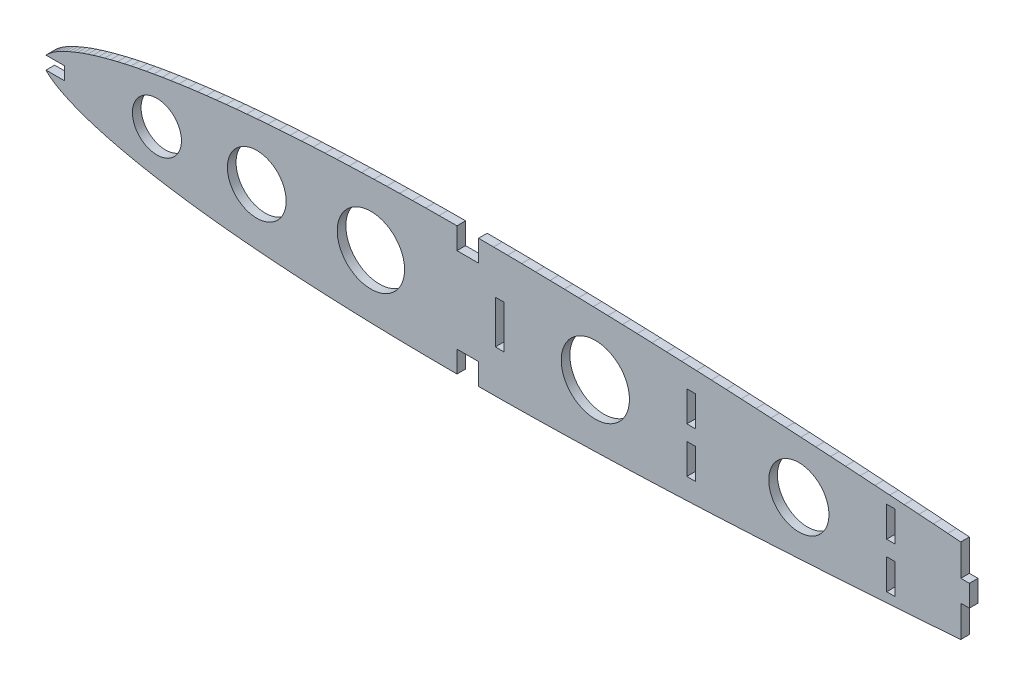
from build123d import *

# Parameters (mm, degrees)
MODEL_R         = 5.687802485
MODEL_R_2       = 6.817016928
MODEL_R_3       = 7.81584039
MODEL_R_4       = 7.917631013
MODEL_R_5       = 6.983479573
MODEL_W         = 2
MODEL_H         = 7.04538
EXTRUDE_2_DEPTH = 2


with BuildPart() as part:
    # Model → 凸台-拉伸2 (new body)
    with BuildSketch(Plane.XY):
        Polygon((62.117439421, 68.543691122), (66.37605038, 68.543691122), (66.37605038, 65.543691122), (62.117439421, 65.543691122), (62.32205038, 65.316691122), (62.68005038, 64.981691122), (63.19905038, 64.553691122), (63.74405038, 64.155691122), (64.30905038, 63.786691122), (65.04805038, 63.352691122), (65.80605038, 62.951691122), (66.57605038, 62.574691122), (67.53205038, 62.136691122), (68.49905038, 61.721691122), (69.47605038, 61.330691122), (70.64005038, 60.897691122), (71.81405038, 60.492691122), (72.99705038, 60.112691122), (74.36805038, 59.701691122), (75.74505038, 59.315691122), (77.12805038, 58.950691122), (78.69705038, 58.561691122), (80.27005038, 58.194691122), (81.84805038, 57.848691122), (83.60905038, 57.486691122), (85.37305038, 57.146691122), (87.14105038, 56.825691122), (89.08505038, 56.493691122), (91.03305038, 56.182691122), (92.98305038, 55.888691122), (95.10505038, 55.589691122), (97.22805038, 55.310691122), (99.35505038, 55.048691122), (101.64605038, 54.784691122), (103.93805038, 54.539691122), (106.23305038, 54.309691122), (108.68205038, 54.081691122), (111.13305038, 53.870691122), (113.58505038, 53.674691122), (116.18305038, 53.483691122), (118.78205038, 53.308691122), (121.38305038, 53.148691122), (124.12105038, 52.995691122), (126.85905038, 52.857691122), (129.59805038, 52.734691122), (132.46505038, 52.619691122), (135.33105038, 52.517691122), (138.19805038, 52.429691122), (141.18005038, 52.351691122), (144.16205038, 52.286691122), (147.14505038, 52.234691122), (150.23305038, 52.193691122), (153.32105038, 52.165691122), (157.483051726, 52.146692018), (157.482051726, 57.146692018), (162.482051726, 57.147692018), (162.483051726, 52.147692018), (165.95205038, 52.165691122), (169.21305038, 52.192691122), (172.47305038, 52.231691122), (175.73305038, 52.280691122), (179.06105038, 52.341691122), (182.38805038, 52.412691122), (185.71605038, 52.492691122), (189.10005038, 52.583691122), (192.48205038, 52.682691122), (195.86505038, 52.790691122), (199.28805038, 52.909691122), (202.71005038, 53.036691122), (206.13205038, 53.171691122), (209.58405038, 53.314691122), (213.03505038, 53.465691122), (216.48605038, 53.624691122), (219.95005038, 53.792691122), (223.41305038, 53.967691122), (226.87605038, 54.151691122), (230.34005038, 54.342691122), (233.80305038, 54.541691122), (237.26605038, 54.743691122), (240.71805038, 54.948691122), (244.16905038, 55.157691122), (247.62005038, 55.372691122), (251.04305038, 55.593691122), (254.46505038, 55.821691122), (257.88705038, 56.054691122), (261.27105038, 56.288691122), (264.65305038, 56.526691122), (268.03605038, 56.769691122), (271.36405038, 57.012691122), (274.376035029, 57.23811468), (274.376035029, 64.543691122), (276.376035029, 64.543691122), (276.376035029, 67.043691122), (276.376035029, 69.543691122), (274.376035029, 69.543691122), (274.376035029, 76.849267564), (271.36405038, 77.074691122), (268.03605038, 77.317691122), (264.65305038, 77.560691122), (261.27105038, 77.798691122), (257.88705038, 78.032691122), (254.46505038, 78.265691122), (251.04305038, 78.493691122), (247.62005038, 78.714691122), (244.16905038, 78.929691122), (240.71805038, 79.138691122), (237.26605038, 79.343691122), (233.80305038, 79.545691122), (230.34005038, 79.744691122), (226.87605038, 79.935691122), (223.41305038, 80.119691122), (219.95005038, 80.294691122), (216.48605038, 80.462691122), (213.03505038, 80.621691122), (209.58405038, 80.772691122), (206.13205038, 80.915691122), (202.71005038, 81.050691122), (199.28805038, 81.177691122), (195.86505038, 81.296691122), (192.48205038, 81.404691122), (189.10005038, 81.503691122), (185.71605038, 81.594691122), (182.38805038, 81.674691122), (179.06105038, 81.745691122), (175.73305038, 81.806691122), (172.47305038, 81.855691122), (169.21305038, 81.894691122), (165.95205038, 81.921691122), (162.483051726, 81.939692018), (162.481051726, 76.939692018), (157.481051726, 76.940692018), (157.483050925, 81.938691122), (153.32105038, 81.921691122), (150.23305038, 81.893691122), (147.14505038, 81.852691122), (144.16205038, 81.800691122), (141.18005038, 81.735691122), (138.19805038, 81.657691122), (135.33105038, 81.569691122), (132.46505038, 81.467691122), (129.59805038, 81.352691122), (126.85905038, 81.229691122), (124.12105038, 81.091691122), (121.38305038, 80.938691122), (118.78205038, 80.778691122), (116.18305038, 80.603691122), (113.58505038, 80.412691122), (111.13305038, 80.216691122), (108.68205038, 80.005691122), (106.23305038, 79.777691122), (103.93805038, 79.547691122), (101.64605038, 79.302691122), (99.35505038, 79.038691122), (97.22805038, 78.776691122), (95.10505038, 78.497691122), (92.98305038, 78.198691122), (91.03305038, 77.904691122), (89.08505038, 77.593691122), (87.14105038, 77.261691122), (85.37305038, 76.940691122), (83.60905038, 76.600691122), (81.84805038, 76.238691122), (80.27005038, 75.892691122), (78.69705038, 75.525691122), (77.12805038, 75.136691122), (75.74505038, 74.771691122), (74.36805038, 74.385691122), (72.99705038, 73.974691122), (71.81405038, 73.594691122), (70.64005038, 73.189691122), (69.47605038, 72.756691122), (68.49905038, 72.365691122), (67.53205038, 71.950691122), (66.57605038, 71.512691122), (65.80605038, 71.135691122), (65.04805038, 70.734691122), (64.30905038, 70.300691122), (63.74405038, 69.931691122), (63.19905038, 69.533691122), (62.68005038, 69.105691122), (62.32205038, 68.770691122), align=None)
        with Locations((87.85605038, 67.043691122)):
            Circle(MODEL_R, mode=Mode.SUBTRACT)
        with Locations((111.02605038, 67.043691122)):
            Circle(MODEL_R_2, mode=Mode.SUBTRACT)
        with Locations((137.50605038, 67.043691122)):
            Circle(MODEL_R_3, mode=Mode.SUBTRACT)
        with Locations((189.583313654, 67.043691122)):
            Circle(MODEL_R_4, mode=Mode.SUBTRACT)
        with Locations((236.80605038, 67.043691122)):
            Circle(MODEL_R_5, mode=Mode.SUBTRACT)
        Polygon((168.378051726, 72.043692018), (166.37605038, 72.043691122), (166.37605038, 62.043691122), (168.378051726, 62.043692018), align=None, mode=Mode.SUBTRACT)
        with Locations((211.813610445, 72.327727018)):
            Rectangle(MODEL_W, MODEL_H, mode=Mode.SUBTRACT)
        with Locations((211.813610445, 61.759657018)):
            Rectangle(MODEL_W, MODEL_H, mode=Mode.SUBTRACT)
        with Locations((258.174689418, 72.327727018)):
            Rectangle(MODEL_W, MODEL_H, mode=Mode.SUBTRACT)
        with Locations((258.174689418, 61.759657018)):
            Rectangle(MODEL_W, MODEL_H, mode=Mode.SUBTRACT)
    extrude(amount=EXTRUDE_2_DEPTH)


solid = part.part
